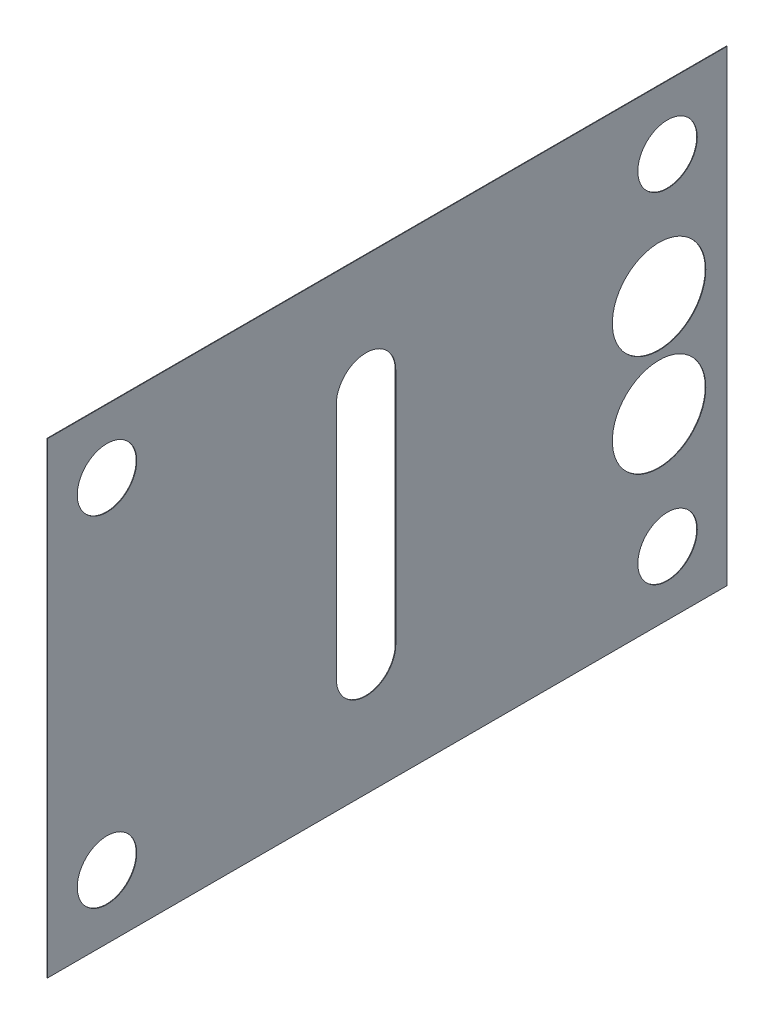
from build123d import *

# Parameters (mm, degrees)
SKETCH1_W             = 160
SKETCH1_H             = 110
BOSS_EXTRUDE1_DEPTH   = 0.127
M12_CLEARANCE_HOLE1_D = 14
CUT_EXTRUDE1_DEPTH    = 98.082522263
M20_CLEARANCE_HOLE1_D = 22


with BuildPart() as part:
    # Sketch1 → Boss-Extrude1 (new body)
    with BuildSketch(Plane(origin=(0, 0, 0), x_dir=(0, 0, -1), z_dir=(1, 0, 0))):
        Rectangle(SKETCH1_W, SKETCH1_H)
    extrude(amount=BOSS_EXTRUDE1_DEPTH)

    # M12 Clearance Hole1 (through all)
    with Locations(Plane(origin=(0.127, 0, 0), x_dir=(0, 0, -1), z_dir=(1, 0, 0))):
        with Locations((-66, 40), (66, 40), (66, -40), (-66, -40)):
            Hole(M12_CLEARANCE_HOLE1_D / 2)

    # Sketch4 → Cut-Extrude1 (cut, through all)
    with BuildSketch(Plane(origin=(0.127, 0, 0), x_dir=(0, 0, -1), z_dir=(1, 0, 0))):
        with BuildLine():
            Line((2, 28), (2, -28))
            ThreePointArc((2, -28), (-5, -35), (-12, -28))
            Line((-12, -28), (-12, 28))
            ThreePointArc((-12, 28), (-5, 35), (2, 28))
        make_face()
    extrude(amount=-CUT_EXTRUDE1_DEPTH, mode=Mode.SUBTRACT)

    # M20 Clearance Hole1 (through all)
    with Locations(Plane(origin=(0.127, 0, 0), x_dir=(0, 0, -1), z_dir=(1, 0, 0))):
        with Locations((64, 12), (64, -12)):
            Hole(M20_CLEARANCE_HOLE1_D / 2)


solid = part.part
